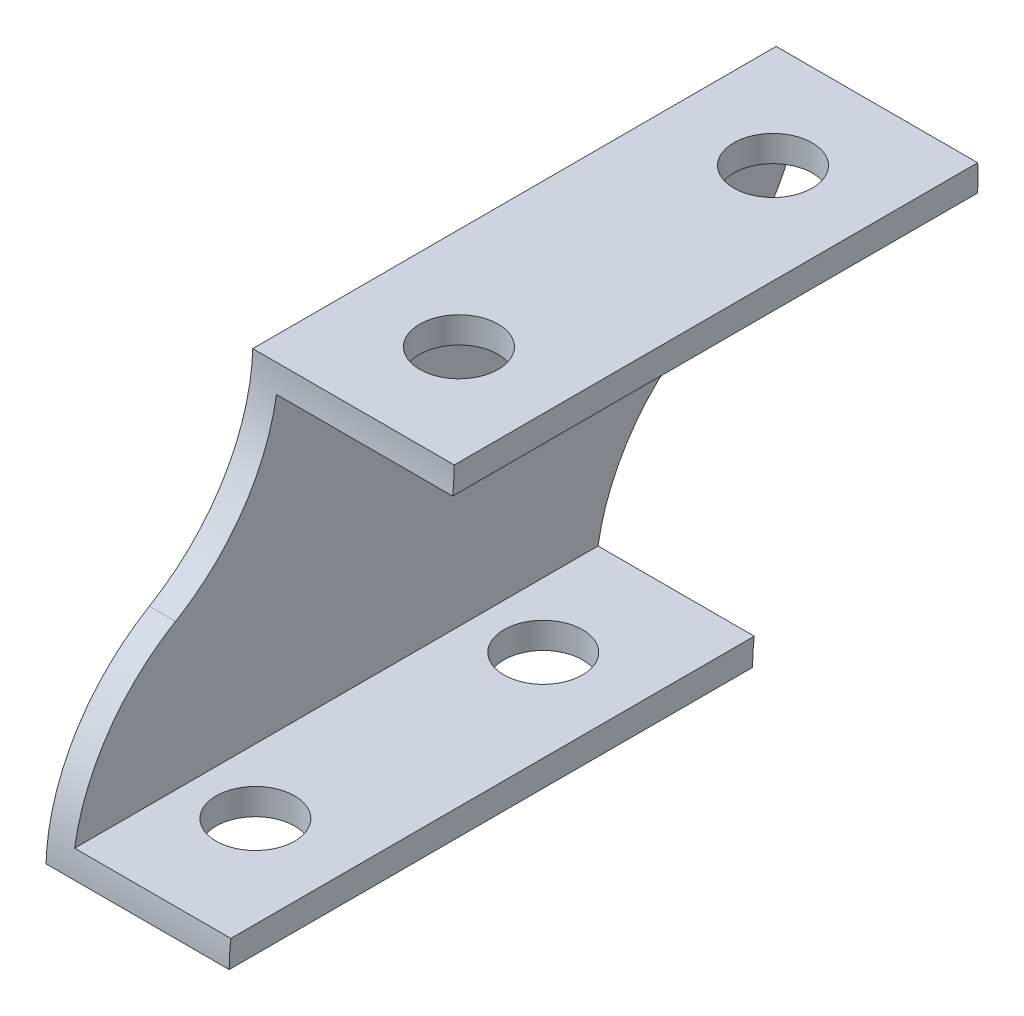
from build123d import *

# Parameters (mm, degrees)
BOSS_EXTRUDE1_DEPTH = 28.5
SKETCH5_R           = 1.5
CUT_EXTRUDE4_DEPTH  = 1
SKETCH11_W          = 1
SKETCH11_H          = 12.5
CUT_EXTRUDE5_DEPTH  = 10
SKETCH12_W          = 20.843481987
SKETCH12_H          = 1.334220042
CUT_EXTRUDE7_DEPTH  = 1
SKETCH13_R          = 1.5
CUT_EXTRUDE8_DEPTH  = 1


with BuildPart() as part:
    # Sketch1 → Boss-Extrude1 (new body)
    with BuildSketch(Plane.XY):
        Polygon((397.82422908, 16), (397.423944987, 2.5), (405.423944987, 2.5), (405.423944987, 3.5), (398.454035145, 3.5), (398.795017891, 15), (405.52422908, 15), (405.52422908, 16), align=None)
    extrude(amount=BOSS_EXTRUDE1_DEPTH)

    # Sketch5 → Cut-Extrude4 (cut)
    with BuildSketch(Plane(origin=(0, 16, 0), x_dir=(1, 0, 0), z_dir=(0, 1, 0))):
        with Locations(Location((401.703493459, -5, 0), (0, 0, 270))):
            Circle(SKETCH5_R)
        with Locations(Location((401.703493459, -17, 0), (0, 0, 270))):
            Circle(SKETCH5_R)
    extrude(amount=-CUT_EXTRUDE4_DEPTH, mode=Mode.SUBTRACT)

    # Sketch11 → Cut-Extrude5 (cut)
    with BuildSketch(Plane(origin=(405.52422908, 0, 0), x_dir=(0, 0, -1), z_dir=(1, 0, 0))):
        with BuildLine():
            ThreePointArc((-24.75, 9.25), (-22.257567862, 11.708863545), (-21.063143846, 15))
            Line((-21.063143846, 15), (-28.5, 15))
            Line((-28.5, 15), (-28.5, 2.5))
            ThreePointArc((-28.5, 2.5), (-27.499550345, 6.360861303), (-24.75, 9.25))
        make_face()
        with BuildLine():
            ThreePointArc((-21.063143846, 15), (-21.015801665, 15.499004205), (-21, 16))
            Line((-21, 16), (-28.5, 16))
            Line((-28.5, 16), (-28.5, 15))
            Line((-28.5, 15), (-21.063143846, 15))
        make_face()
        with Locations((-0.5, 8.75)):
            Rectangle(SKETCH11_W, SKETCH11_H)
        with BuildLine():
            Line((0, 15), (0, 16))
            Line((0, 16), (-1, 16))
            ThreePointArc((-1, 16), (-0.986298018, 15.553268089), (-1, 15.106536177))
            Line((-1, 15.106536177), (-1, 15))
            Line((-1, 15), (0, 15))
        make_face()
        with BuildLine():
            Line((-1, 2.5), (-1, 15))
            Line((-1, 15), (-1.007325107, 15))
            ThreePointArc((-1.007325107, 15), (-2.100816605, 11.679499144), (-4.614575443, 9.25))
            ThreePointArc((-4.614575443, 9.25), (-7.459265697, 6.394195167), (-8.5, 2.5))
            Line((-8.5, 2.5), (-2.5, 2.5))
            Line((-2.5, 2.5), (-1, 2.5))
        make_face()
    extrude(amount=-CUT_EXTRUDE5_DEPTH, mode=Mode.SUBTRACT)

    # Sketch12 → Cut-Extrude7 (cut)
    with BuildSketch(Plane(origin=(405.423944987, 0, 0), x_dir=(0, 0, -1), z_dir=(1, 0, 0))):
        with Locations((-18.404841791, 2.845743799)):
            Rectangle(SKETCH12_W, SKETCH12_H)
    extrude(amount=-CUT_EXTRUDE7_DEPTH, mode=Mode.SUBTRACT)

    # Sketch13 → Cut-Extrude8 (cut)
    with BuildSketch(Plane.XZ.offset(-2.5)):
        with Locations((400.923944987, 24)):
            Circle(SKETCH13_R)
        with Locations((400.923944987, 13)):
            Circle(SKETCH13_R)
    extrude(amount=-CUT_EXTRUDE8_DEPTH, mode=Mode.SUBTRACT)


solid = part.part
